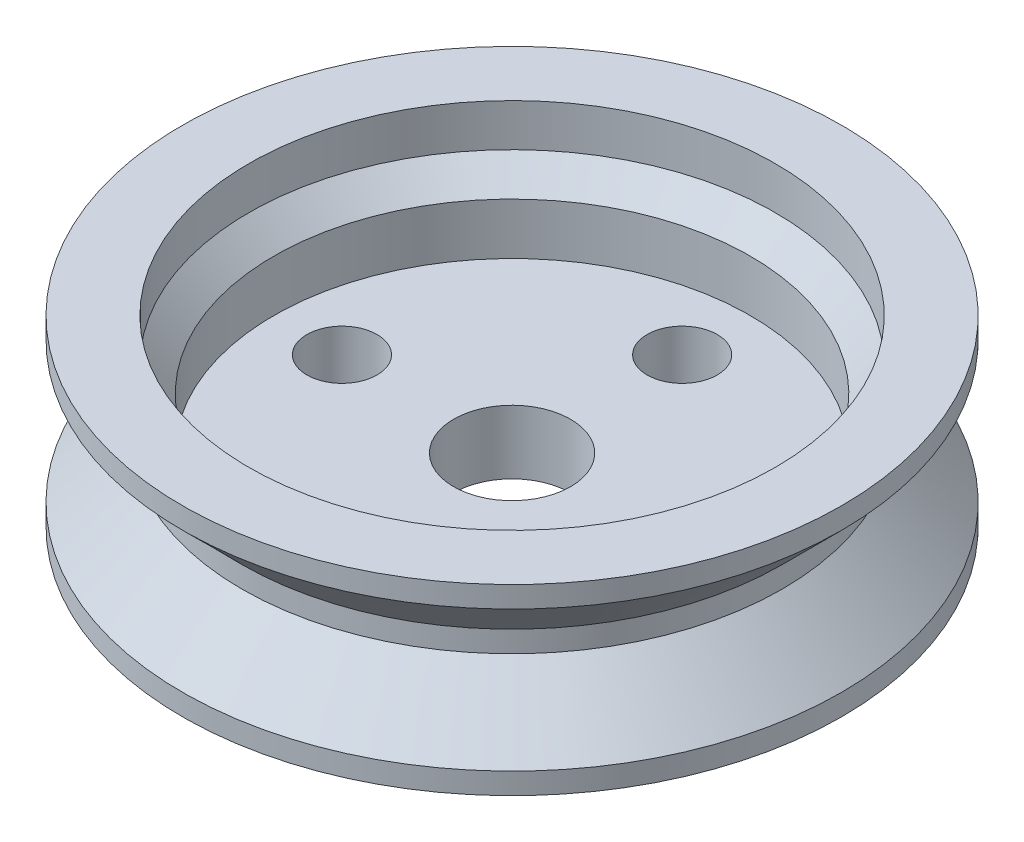
from build123d import *

# Parameters (mm, degrees)
SKETCH_3_R          = 2.75
SKETCH_3_R_2        = 1.65
CUT_EXTRUDE_1_DEPTH = 24.546974328


with BuildPart() as part:
    # 草图2 → 旋转1 (revolve)
    with BuildSketch(Plane.XY):
        Polygon((0, 0), (-15.5, 0), (-15.5, 1), (-12.7, 3.8), (-12.7, 4.8), (-15.5, 7.6), (-15.5, 8.6), (-12.378679656, 8.6), (-12.378679656, 6.6), (-11.2, 5.421320344), (-11.2, 3), (0, 3), (0, 1.5), align=None)
    revolve(axis=Axis((0, 0, 0), (0, 1, 0)))

    # 草图3 → 切除-拉伸1 (cut, through all)
    with BuildSketch(Plane.XZ):
        Circle(SKETCH_3_R)
        with Locations((0, 8)):
            Circle(SKETCH_3_R_2)
        with Locations((8, 0)):
            Circle(SKETCH_3_R_2)
        with Locations((0, -8)):
            Circle(SKETCH_3_R_2)
        with Locations((-8, 0)):
            Circle(SKETCH_3_R_2)
    extrude(amount=-CUT_EXTRUDE_1_DEPTH, mode=Mode.SUBTRACT)


solid = part.part
